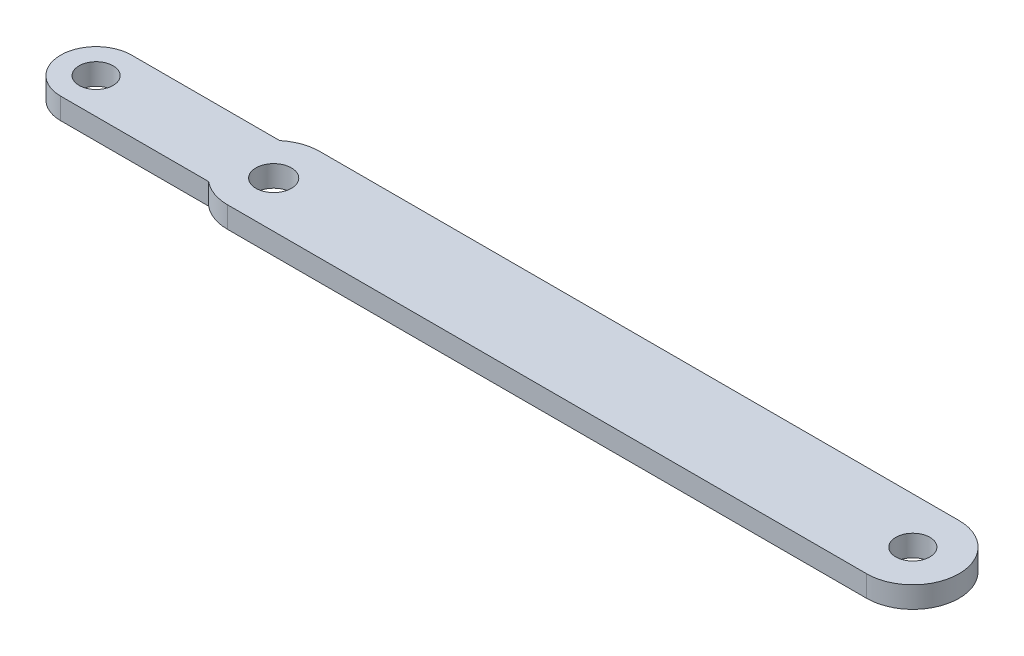
from build123d import *

# Parameters (mm, degrees)
SKETCH2_R           = 2.5
SKETCH2_R_2         = 2.4
BOSS_EXTRUDE1_DEPTH = 3


with BuildPart() as part:
    # Sketch2 → Boss-Extrude1 (new body)
    with BuildSketch(Plane(origin=(0, 0, 0), x_dir=(1, 0, 0), z_dir=(0, 1, 0))):
        with BuildLine():
            Line((87.593623105, 198.818492307), (-2.406376895, 198.818492307))
            ThreePointArc((-2.406376895, 198.818492307), (-4.614317112, 198.432001937), (-6.559688827, 197.318492307))
            Line((-6.559688827, 197.318492307), (-27.406376895, 197.318492307))
            ThreePointArc((-27.406376895, 197.318492307), (-32.406376895, 192.318492307), (-27.406376895, 187.318492307))
            Line((-27.406376895, 187.318492307), (-6.559688827, 187.318492307))
            ThreePointArc((-6.559688827, 187.318492307), (-4.614317112, 186.204982677), (-2.406376895, 185.818492307))
            Line((-2.406376895, 185.818492307), (87.593623105, 185.818492307))
            ThreePointArc((87.593623105, 185.818492307), (94.093623105, 192.318492307), (87.593623105, 198.818492307))
        make_face()
        with Locations(Location((-2.406376895, 192.318492307, 0), (0, 0, 270))):
            Circle(SKETCH2_R, mode=Mode.SUBTRACT)
        with Locations(Location((87.593623105, 192.318492307, 0), (0, 0, 270))):
            Circle(SKETCH2_R_2, mode=Mode.SUBTRACT)
        with Locations(Location((-27.406376895, 192.318492307, 0), (0, 0, 270))):
            Circle(SKETCH2_R_2, mode=Mode.SUBTRACT)
    extrude(amount=BOSS_EXTRUDE1_DEPTH)


solid = part.part
